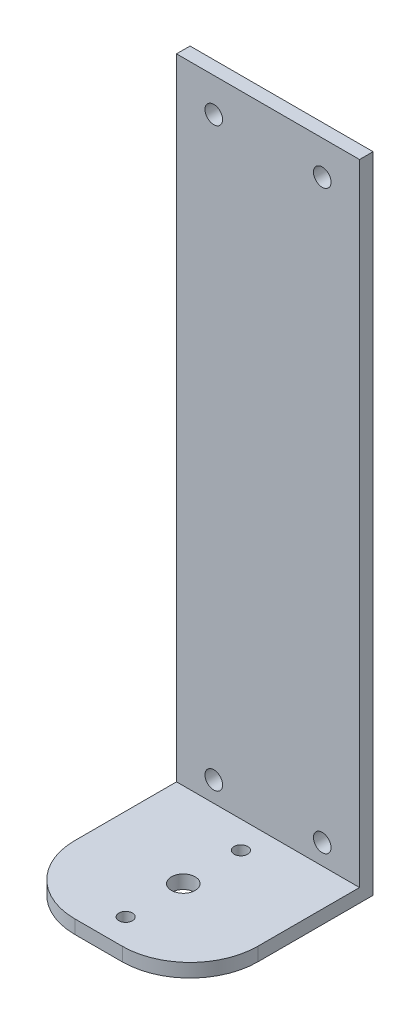
from build123d import *

# Parameters (mm, degrees)
SKETCH1_W           = 27
SKETCH1_H           = 27
BOSS_EXTRUDE1_DEPTH = 27
CUT_EXTRUDE1_REACH  = 43.32
SKETCH2_W           = 25
SKETCH2_H           = 25
CUT_EXTRUDE2_REACH  = 45.313
SKETCH3_R           = 1.75
SKETCH3_R_2         = 1
SKETCH4_W           = 27
SKETCH4_H           = 68
BOSS_EXTRUDE2_DEPTH = 2
CUT_EXTRUDE3_REACH  = 92.375
SKETCH5_R           = 1.3
FILLET1_R           = 10


with BuildPart() as part:
    # Sketch1 → Boss-Extrude1 (new body)
    with BuildSketch(Plane(origin=(0, 0, 0), x_dir=(0, 1, 0), z_dir=(0, 0, 1))):
        with Locations((2.289473684, -9.347039474)):
            Rectangle(SKETCH1_W, SKETCH1_H)
    extrude(amount=BOSS_EXTRUDE1_DEPTH)

    # Sketch2 → Cut-Extrude1 (cut, up to next)
    with BuildSketch(Plane.YZ.offset(22.847039474), mode=Mode.PRIVATE) as cut_extrude1_sk1:
        with Locations((3.289473684, 14.5)):
            Rectangle(SKETCH2_W, SKETCH2_H)
    cut_extrude1_tool1 = extrude(cut_extrude1_sk1.sketch, amount=-CUT_EXTRUDE1_REACH, mode=Mode.PRIVATE) & part.part
    add(cut_extrude1_tool1.solids().sort_by_distance((22.847039, 3.289474, 14.5))[0], mode=Mode.SUBTRACT)

    # Sketch3 → Cut-Extrude2 (cut, up to next)
    with BuildSketch(Plane(origin=(0, -9.210526316, 0), x_dir=(-1, 0, 0), z_dir=(0, 1, 0)), mode=Mode.PRIVATE) as cut_extrude2_sk1:
        with Locations(Location((-9.347039474, 14.5, 0), (0, 0, 90))):
            Circle(SKETCH3_R)
    cut_extrude2_tool1 = extrude(cut_extrude2_sk1.sketch, amount=-CUT_EXTRUDE2_REACH, mode=Mode.PRIVATE) & part.part
    # Sketch3 → Cut-Extrude2 (cut, up to next)
    with BuildSketch(Plane(origin=(0, -9.210526316, 0), x_dir=(-1, 0, 0), z_dir=(0, 1, 0)), mode=Mode.PRIVATE) as cut_extrude2_sk2:
        with Locations(Location((-9.347039474, 23, 0), (0, 0, 90))):
            Circle(SKETCH3_R_2)
    cut_extrude2_tool2 = extrude(cut_extrude2_sk2.sketch, amount=-CUT_EXTRUDE2_REACH, mode=Mode.PRIVATE) & part.part
    # Sketch3 → Cut-Extrude2 (cut, up to next)
    with BuildSketch(Plane(origin=(0, -9.210526316, 0), x_dir=(-1, 0, 0), z_dir=(0, 1, 0)), mode=Mode.PRIVATE) as cut_extrude2_sk3:
        with Locations((-9.347039474, 6)):
            Circle(SKETCH3_R_2)
    cut_extrude2_tool3 = extrude(cut_extrude2_sk3.sketch, amount=-CUT_EXTRUDE2_REACH, mode=Mode.PRIVATE) & part.part
    add(cut_extrude2_tool1.solids().sort_by_distance((9.347039, -9.210526, 14.5))[0], mode=Mode.SUBTRACT)
    add(cut_extrude2_tool2.solids().sort_by_distance((9.347039, -9.210526, 23))[0], mode=Mode.SUBTRACT)
    add(cut_extrude2_tool3.solids().sort_by_distance((9.347039, -9.210526, 6))[0], mode=Mode.SUBTRACT)

    # Sketch4 → Boss-Extrude2 (add)
    with BuildSketch(Plane.XY.offset(2)):
        with Locations((9.347039474, 49.789473684)):
            Rectangle(SKETCH4_W, SKETCH4_H)
    extrude(amount=-BOSS_EXTRUDE2_DEPTH)

    # Sketch5 → Cut-Extrude3 (cut, up to next)
    with BuildSketch(Plane.XY.offset(2), mode=Mode.PRIVATE) as cut_extrude3_sk1:
        with Locations((1.347039474, -6.210526316)):
            Circle(SKETCH5_R)
    cut_extrude3_tool1 = extrude(cut_extrude3_sk1.sketch, amount=-CUT_EXTRUDE3_REACH, mode=Mode.PRIVATE) & part.part
    # Sketch5 → Cut-Extrude3 (cut, up to next)
    with BuildSketch(Plane.XY.offset(2), mode=Mode.PRIVATE) as cut_extrude3_sk2:
        with Locations((1.347039474, 78.789473684)):
            Circle(SKETCH5_R)
    cut_extrude3_tool2 = extrude(cut_extrude3_sk2.sketch, amount=-CUT_EXTRUDE3_REACH, mode=Mode.PRIVATE) & part.part
    # Sketch5 → Cut-Extrude3 (cut, up to next)
    with BuildSketch(Plane.XY.offset(2), mode=Mode.PRIVATE) as cut_extrude3_sk3:
        with Locations((17.347039474, -6.210526316)):
            Circle(SKETCH5_R)
    cut_extrude3_tool3 = extrude(cut_extrude3_sk3.sketch, amount=-CUT_EXTRUDE3_REACH, mode=Mode.PRIVATE) & part.part
    # Sketch5 → Cut-Extrude3 (cut, up to next)
    with BuildSketch(Plane.XY.offset(2), mode=Mode.PRIVATE) as cut_extrude3_sk4:
        with Locations((17.347039474, 78.789473684)):
            Circle(SKETCH5_R)
    cut_extrude3_tool4 = extrude(cut_extrude3_sk4.sketch, amount=-CUT_EXTRUDE3_REACH, mode=Mode.PRIVATE) & part.part
    add(cut_extrude3_tool1.solids().sort_by_distance((1.347039, -6.210526, 2))[0], mode=Mode.SUBTRACT)
    add(cut_extrude3_tool2.solids().sort_by_distance((1.347039, 78.789474, 2))[0], mode=Mode.SUBTRACT)
    add(cut_extrude3_tool3.solids().sort_by_distance((17.347039, -6.210526, 2))[0], mode=Mode.SUBTRACT)
    add(cut_extrude3_tool4.solids().sort_by_distance((17.347039, 78.789474, 2))[0], mode=Mode.SUBTRACT)

    # Fillet1
    fillet1_edges = [part.edges().sort_by_distance(p)[0] for p in [
        (-4.152960526, -10.210526316, 27),
        (22.847039474, -10.210526316, 27),
    ]]
    fillet(fillet1_edges, radius=FILLET1_R)


solid = part.part
